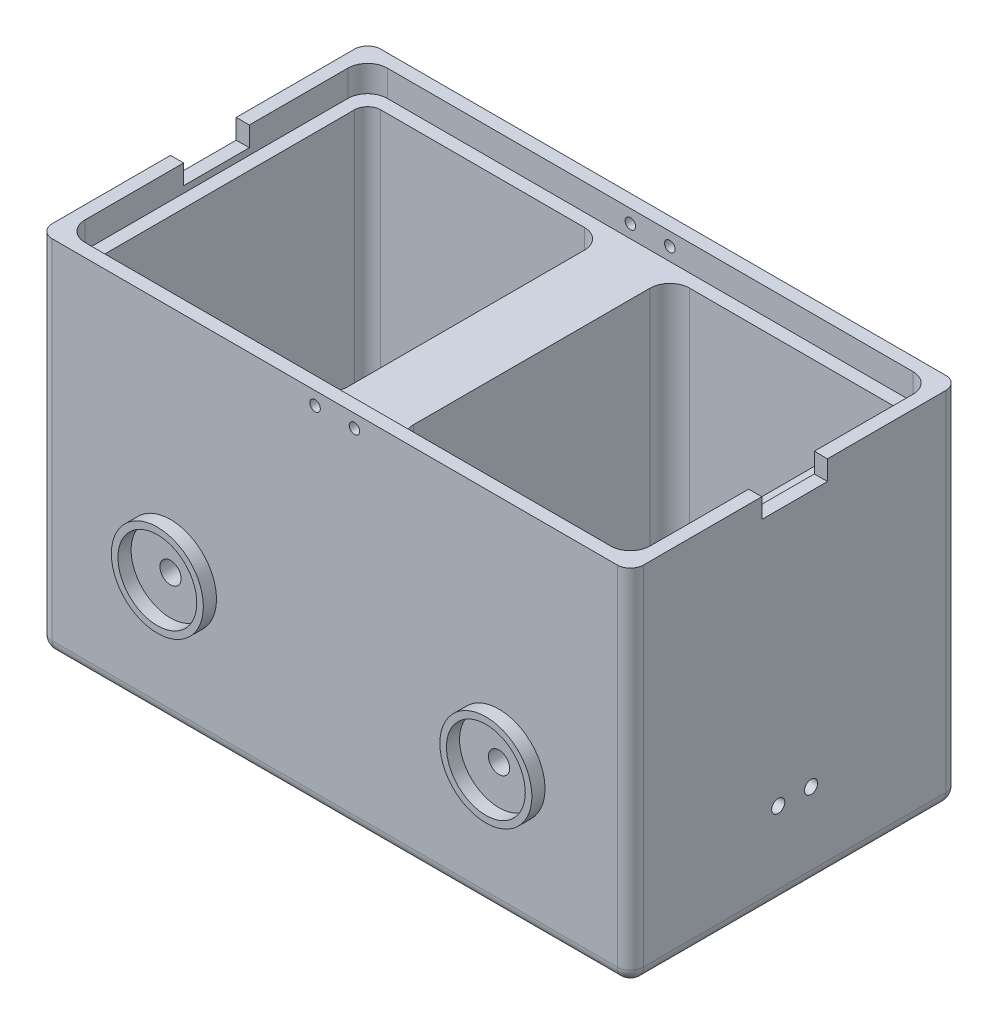
from build123d import *

# Parameters (mm, degrees)
BOSS_EXTRUDE1_DEPTH = 55
BOSS_EXTRUDE2_DEPTH = 4
CUT_EXTRUDE1_DEPTH  = 4
SKETCH6_R           = 7
BOSS_EXTRUDE3_DEPTH = 2
SKETCH7_R           = 6
CUT_EXTRUDE2_DEPTH  = 2
SKETCH8_R           = 1.613905717
CUT_EXTRUDE4_DEPTH  = 13
SKETCH9_R           = 6
CUT_EXTRUDE5_DEPTH  = 2
SKETCH11_R          = 1.615
CUT_EXTRUDE6_DEPTH  = 6
FILLET1_R           = 2
SKETCH14_R          = 7
SKETCH14_R_2        = 6
BOSS_EXTRUDE5_DEPTH = 2
CUT_EXTRUDE7_START  = -6
SKETCH15_R          = 1.615
SKETCH15_R_2        = 1.613905717
CUT_EXTRUDE7_DEPTH  = 6
SKETCH16_R          = 1
CUT_EXTRUDE9_DEPTH  = 6
CUT_EXTRUDE10_START = -6
SKETCH17_R          = 1
CUT_EXTRUDE10_DEPTH = 6
SKETCH18_W          = 2.103885612
SKETCH18_H          = 10
CUT_EXTRUDE12_DEPTH = 3
CUT_EXTRUDE13_REACH = 90.057
SKETCH19_R          = 0.8


with BuildPart() as part:
    # Sketch1 → Boss-Extrude1 (new body)
    with BuildSketch(Plane(origin=(0, 0, 0), x_dir=(1, 0, 0), z_dir=(0, 1, 0))):
        with BuildLine():
            Line((-43, 25), (43, 25))
            ThreePointArc((43, 25), (44.414213562, 24.414213562), (45, 23))
            Line((45, 23), (45, -23))
            ThreePointArc((45, -23), (44.414213562, -24.414213562), (43, -25))
            Line((43, -25), (-43, -25))
            ThreePointArc((-43, -25), (-44.414213562, -24.414213562), (-45, -23))
            Line((-45, -23), (-45, 23))
            ThreePointArc((-45, 23), (-44.414213562, 24.414213562), (-43, 25))
        make_face()
        with BuildLine():
            Line((-5, 18), (-5, -18))
            ThreePointArc((-5, -18), (-5.878679656, -20.121320344), (-8, -21))
            Line((-8, -21), (-39, -21))
            ThreePointArc((-39, -21), (-40.414213562, -20.414213562), (-41, -19))
            Line((-41, -19), (-41, 19))
            ThreePointArc((-41, 19), (-40.414213562, 20.414213562), (-39, 21))
            Line((-39, 21), (-8, 21))
            ThreePointArc((-8, 21), (-5.878679656, 20.121320344), (-5, 18))
        make_face(mode=Mode.SUBTRACT)
        with BuildLine():
            Line((41, 19), (41, -18))
            ThreePointArc((41, -18), (40.121320344, -20.121320344), (38, -21))
            Line((38, -21), (8, -21))
            ThreePointArc((8, -21), (5.878679656, -20.121320344), (5, -18))
            Line((5, -18), (5, 18))
            ThreePointArc((5, 18), (5.878679656, 20.121320344), (8, 21))
            Line((8, 21), (39, 21))
            ThreePointArc((39, 21), (40.414213562, 20.414213562), (41, 19))
        make_face(mode=Mode.SUBTRACT)
    extrude(amount=BOSS_EXTRUDE1_DEPTH)

    # Sketch2 → Boss-Extrude2 (add)
    with BuildSketch(Plane.XZ):
        with BuildLine():
            Line((45, 23), (45, -23))
            ThreePointArc((45, -23), (44.414213562, -24.414213562), (43, -25))
            Line((43, -25), (-43, -25))
            ThreePointArc((-43, -25), (-44.414213562, -24.414213562), (-45, -23))
            Line((-45, -23), (-45, 23))
            ThreePointArc((-45, 23), (-44.414213562, 24.414213562), (-43, 25))
            Line((-43, 25), (43, 25))
            ThreePointArc((43, 25), (44.414213562, 24.414213562), (45, 23))
        make_face()
    extrude(amount=-BOSS_EXTRUDE2_DEPTH)

    # Sketch5 → Cut-Extrude1 (cut)
    with BuildSketch(Plane(origin=(0, 55, 0), x_dir=(1, 0, 0), z_dir=(0, 1, 0))):
        with BuildLine():
            Line((-40, 23), (40, 23))
            ThreePointArc((40, 23), (42.121320344, 22.121320344), (43, 20))
            Line((43, 20), (43, -20))
            ThreePointArc((43, -20), (42.121320344, -22.121320344), (40, -23))
            Line((40, -23), (-40, -23))
            ThreePointArc((-40, -23), (-42.121320344, -22.121320344), (-43, -20))
            Line((-43, -20), (-43, 20))
            ThreePointArc((-43, 20), (-42.121320344, 22.121320344), (-40, 23))
        make_face()
    extrude(amount=-CUT_EXTRUDE1_DEPTH, mode=Mode.SUBTRACT)

    # Sketch6 → Boss-Extrude3 (add)
    with BuildSketch(Plane.XY.offset(25)):
        with Locations(Location((-25, 20, 0), (0, 0, 180))):
            Circle(SKETCH6_R)
        with Locations(Location((25, 20, 0), (0, 0, 180))):
            Circle(SKETCH6_R)
    extrude(amount=BOSS_EXTRUDE3_DEPTH)

    # Sketch7 → Cut-Extrude2 (cut)
    with BuildSketch(Plane.XY.offset(27)):
        with Locations((25, 20)):
            Circle(SKETCH7_R)
    extrude(amount=-CUT_EXTRUDE2_DEPTH, mode=Mode.SUBTRACT)

    # Sketch8 → Cut-Extrude4 (cut)
    with BuildSketch(Plane.XY.offset(25)):
        with Locations((25, 20)):
            Circle(SKETCH8_R)
    extrude(amount=-CUT_EXTRUDE4_DEPTH, mode=Mode.SUBTRACT)

    # Sketch9 → Cut-Extrude5 (cut)
    with BuildSketch(Plane.XY.offset(27)):
        with Locations((-25, 20)):
            Circle(SKETCH9_R)
    extrude(amount=-CUT_EXTRUDE5_DEPTH, mode=Mode.SUBTRACT)

    # Sketch11 → Cut-Extrude6 (cut)
    with BuildSketch(Plane.XY.offset(25)):
        with Locations((-25, 20)):
            Circle(SKETCH11_R)
    extrude(amount=-CUT_EXTRUDE6_DEPTH, mode=Mode.SUBTRACT)

    # Fillet1
    fillet1_edges = [part.edges().sort_by_distance(p)[0] for p in [
        (0, 0, -25),
        (44.414213562, 0, -24.414213562),
        (45, 0, 0),
        (44.414213562, 0, 24.414213562),
        (0, 0, 25),
        (-44.414213562, 0, 24.414213562),
        (-45, 0, 0),
        (-44.414213562, 0, -24.414213562),
    ]]
    fillet(fillet1_edges, radius=FILLET1_R)

    # Sketch14 → Boss-Extrude5 (add)
    # profile 1 of 2: a face of its own
    with BuildSketch(Plane(origin=(0, 0, -25), x_dir=(-1, 0, 0), z_dir=(0, 0, -1))):
        with Locations((-25, 20)):
            Circle(SKETCH14_R)
        with Locations(Location((-25, 20, 0), (0, 0, 180))):
            Circle(SKETCH14_R_2, mode=Mode.SUBTRACT)
    # profile 2 of 2: a face of its own
    with BuildSketch(Plane(origin=(0, 0, -25), x_dir=(-1, 0, 0), z_dir=(0, 0, -1))):
        with Locations((25, 20)):
            Circle(SKETCH14_R)
        with Locations(Location((25, 20, 0), (0, 0, 180))):
            Circle(SKETCH14_R_2, mode=Mode.SUBTRACT)
    extrude(amount=BOSS_EXTRUDE5_DEPTH)

    # Sketch15 → Cut-Extrude7 (cut)
    with BuildSketch(Plane(origin=(0, 0, -25), x_dir=(-1, 0, 0), z_dir=(0, 0, -1)).offset(CUT_EXTRUDE7_START)):
        with Locations(Location((25, 20, 0), (0, 0, 180))):
            Circle(SKETCH15_R)
        with Locations(Location((-25, 20, 0), (0, 0, 180))):
            Circle(SKETCH15_R_2)
    extrude(amount=CUT_EXTRUDE7_DEPTH, mode=Mode.SUBTRACT)

    # Sketch16 → Cut-Extrude9 (cut)
    with BuildSketch(Plane(origin=(45, 0, 0), x_dir=(0, 0, -1), z_dir=(1, 0, 0))):
        with Locations((-2.5, 13)):
            Circle(SKETCH16_R)
        with Locations(Location((2.5, 13, 0), (0, 0, 180))):
            Circle(SKETCH16_R)
    extrude(amount=-CUT_EXTRUDE9_DEPTH, mode=Mode.SUBTRACT)

    # Sketch17 → Cut-Extrude10 (cut)
    with BuildSketch(Plane.ZY.offset(45).offset(CUT_EXTRUDE10_START)):
        with Locations((-2.5, 13)):
            Circle(SKETCH17_R)
        with Locations(Location((2.5, 13, 0), (0, 0, 180))):
            Circle(SKETCH17_R)
    extrude(amount=CUT_EXTRUDE10_DEPTH, mode=Mode.SUBTRACT)

    # Sketch18 → Cut-Extrude12 (cut)
    with BuildSketch(Plane(origin=(0, 55, 0), x_dir=(1, 0, 0), z_dir=(0, 1, 0))):
        with Locations((43.955041237, 0)):
            Rectangle(SKETCH18_W, SKETCH18_H)
        with Locations((-43.955041237, 0)):
            Rectangle(SKETCH18_W, SKETCH18_H)
    extrude(amount=-CUT_EXTRUDE12_DEPTH, mode=Mode.SUBTRACT)

    # Cut-Extrude13: up to this face of the body (flat: up to its plane)
    cut_extrude13_end = Plane(part.part.faces().sort_by_distance((0, 29.115734207, -25))[0])
    # Sketch19 → Cut-Extrude13 (cut, up to the picked face)
    with BuildSketch(Plane.XY.offset(25), mode=Mode.PRIVATE) as cut_extrude13_sk1:
        with Locations((-3, 53)):
            Circle(SKETCH19_R)
    cut_extrude13_tool1 = split(extrude(cut_extrude13_sk1.sketch, amount=-CUT_EXTRUDE13_REACH, mode=Mode.PRIVATE), bisect_by=cut_extrude13_end, keep=Keep.BOTH, mode=Mode.PRIVATE)
    # Sketch19 → Cut-Extrude13 (cut, up to the picked face)
    with BuildSketch(Plane.XY.offset(25), mode=Mode.PRIVATE) as cut_extrude13_sk2:
        with Locations((3, 53)):
            Circle(SKETCH19_R)
    cut_extrude13_tool2 = split(extrude(cut_extrude13_sk2.sketch, amount=-CUT_EXTRUDE13_REACH, mode=Mode.PRIVATE), bisect_by=cut_extrude13_end, keep=Keep.BOTH, mode=Mode.PRIVATE)
    add(cut_extrude13_tool1.solids().sort_by(Axis((-3, 53, 25), (0, 0, -1)))[0], mode=Mode.SUBTRACT)
    add(cut_extrude13_tool2.solids().sort_by(Axis((3, 53, 25), (0, 0, -1)))[0], mode=Mode.SUBTRACT)


solid = part.part
